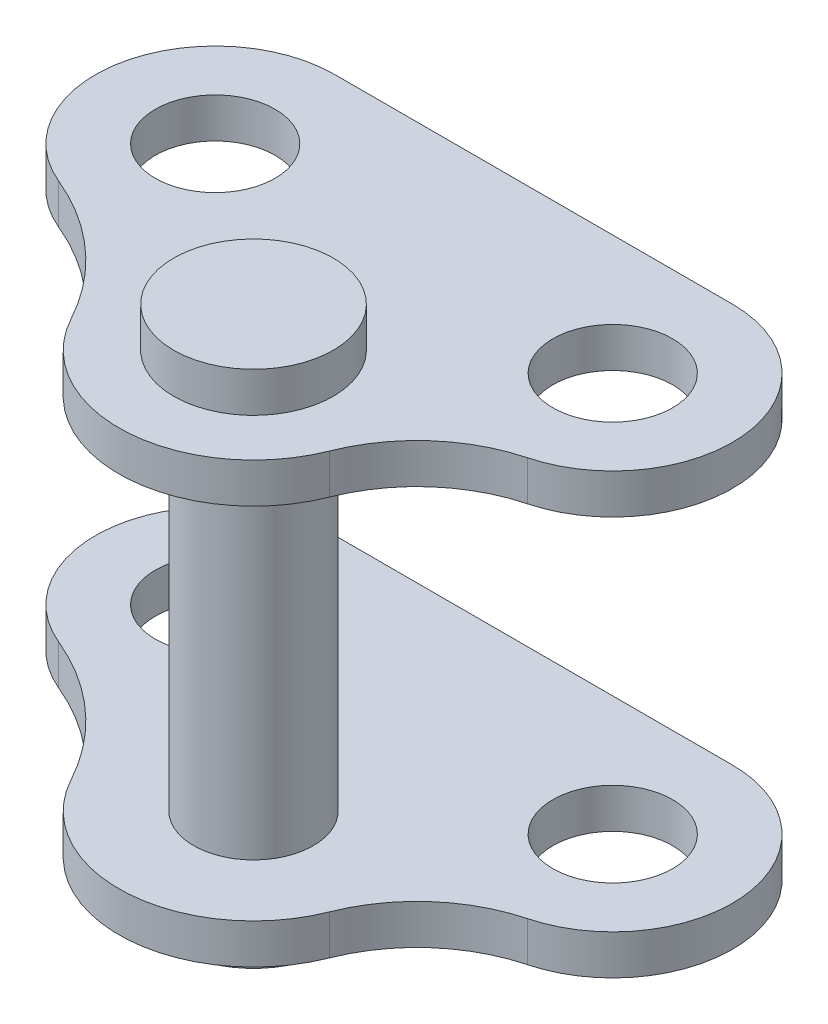
from build123d import *

# Parameters (mm, degrees)
SKETCH1_R           = 2.38125
BOSS_EXTRUDE1_DEPTH = 1.5875
SKETCH2_R           = 3.175
BOSS_EXTRUDE2_DEPTH = 1.5875
SKETCH3_R           = 2.38125
BOSS_EXTRUDE3_DEPTH = 19.05
SKETCH4_R           = 3.175
BOSS_EXTRUDE4_DEPTH = 1.5875
SKETCH5_R           = 2.38125
BOSS_EXTRUDE5_DEPTH = 1.5875


with BuildPart() as part:
    # Sketch1 → Boss-Extrude1 (new body)
    with BuildSketch(Plane(origin=(0, 0, 0), x_dir=(1, 0, 0), z_dir=(0, 1, 0))):
        with BuildLine():
            Line((9.398005644, 4.762076723), (-6.35, 4.7625))
            ThreePointArc((-6.35, 4.7625), (-11.020584629, 0.931152767), (-8.176363381, -4.398386414))
            ThreePointArc((-8.176363381, -4.398386414), (-5.292234705, -6.221263486), (-3.181508348, -8.901918869))
            ThreePointArc((-3.181508348, -8.901918869), (1.849687492, -11.693035316), (6.504625866, -8.311495529))
            ThreePointArc((6.504625866, -8.311495529), (8.146827792, -5.96033805), (10.67447942, -4.60544104))
            ThreePointArc((10.67447942, -4.60544104), (14.180390361, 0.643024113), (9.398005644, 4.762076723))
        make_face()
        with Locations(Location((-6.35, 0, 0), (0, 0, 270))):
            Circle(SKETCH1_R, mode=Mode.SUBTRACT)
        with Locations(Location((9.4615, 0, 0), (0, 0, 270))):
            Circle(SKETCH1_R, mode=Mode.SUBTRACT)
        with Locations(Location((1.524, -6.35, 0), (0, 0, 270))):
            Circle(SKETCH1_R, mode=Mode.SUBTRACT)
    extrude(amount=BOSS_EXTRUDE1_DEPTH)

    # Sketch2 → Boss-Extrude2 (add)
    with BuildSketch(Plane.XZ):
        with Locations(Location((1.524, 6.35, 0), (0, 0, 90))):
            Circle(SKETCH2_R)
    extrude(amount=BOSS_EXTRUDE2_DEPTH)

    # Sketch3 → Boss-Extrude3 (add)
    with BuildSketch(Plane(origin=(0, 0, 0), x_dir=(1, 0, 0), z_dir=(0, 1, 0))):
        with Locations(Location((1.524, -6.35, 0), (0, 0, 90))):
            Circle(SKETCH3_R)
    extrude(amount=BOSS_EXTRUDE3_DEPTH)

    # Sketch4 → Boss-Extrude4 (add)
    with BuildSketch(Plane(origin=(0, 19.05, 0), x_dir=(1, 0, 0), z_dir=(0, 1, 0))):
        with Locations(Location((1.524, -6.35, 0), (0, 0, 270))):
            Circle(SKETCH4_R)
    extrude(amount=-BOSS_EXTRUDE4_DEPTH)


with BuildPart() as body_2:
    # Sketch5 → Boss-Extrude5 (new body)
    with BuildSketch(Plane.XZ.offset(-17.4625)):
        with BuildLine():
            ThreePointArc((-8.176363381, 4.398386414), (-11.020584629, -0.931152767), (-6.35, -4.7625))
            Line((-6.35, -4.7625), (9.4615, -4.7625))
            ThreePointArc((9.4615, -4.7625), (14.184572051, -0.611552653), (10.67447942, 4.60544104))
            ThreePointArc((10.67447942, 4.60544104), (8.146827792, 5.96033805), (6.504625866, 8.311495529))
            ThreePointArc((6.504625866, 8.311495529), (1.849687492, 11.693035316), (-3.181508348, 8.901918869))
            ThreePointArc((-3.181508348, 8.901918869), (-5.292234705, 6.221263486), (-8.176363381, 4.398386414))
        make_face()
        with Locations(Location((-6.35, 0, 0), (0, 0, 270))):
            Circle(SKETCH5_R, mode=Mode.SUBTRACT)
        with Locations(Location((9.4615, 0, 0), (0, 0, 270))):
            Circle(SKETCH5_R, mode=Mode.SUBTRACT)
        with Locations(Location((1.524, 6.35, 0), (0, 0, 270))):
            Circle(SKETCH5_R, mode=Mode.SUBTRACT)
    extrude(amount=BOSS_EXTRUDE5_DEPTH)


solid = Compound([part.part, body_2.part])
